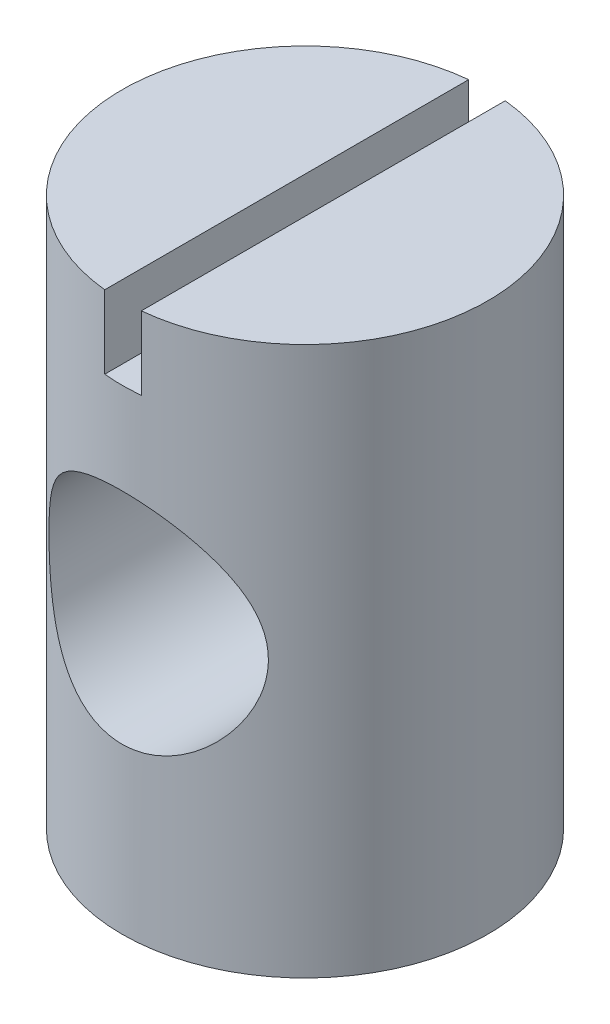
from build123d import *

# Parameters (mm, degrees)
SKETCH_1_R               = 5
EXTRUDE_1_DEPTH          = 15
SKETCH_2_W               = 1
SKETCH_2_H               = 10
CUT_EXTRUDE_1_DEPTH      = 2
CUT_EXTRUDE_2_DEPTH      = 5
CUT_EXTRUDE_2_DEPTH_BACK = 5
SKETCH_3_R               = 3


with BuildPart() as part:
    # Эскиз1 → Бобышка-Вытянуть1 (new body)
    with BuildSketch(Plane(origin=(0, 0, 0), x_dir=(1, 0, 0), z_dir=(0, 1, 0))):
        Circle(SKETCH_1_R)
    extrude(amount=EXTRUDE_1_DEPTH)

    # Эскиз2 → Вырез-Вытянуть1 (cut)
    with BuildSketch(Plane(origin=(0, 15, 0), x_dir=(1, 0, 0), z_dir=(0, 1, 0))):
        Rectangle(SKETCH_2_W, SKETCH_2_H)
    extrude(amount=-CUT_EXTRUDE_1_DEPTH, mode=Mode.SUBTRACT)

    # Эскиз3 → Вырез-Вытянуть2 (cut, two sides: drawn at the far end of the back side and taken through both)
    with BuildSketch(Plane.XY.offset(-CUT_EXTRUDE_2_DEPTH_BACK)):
        with Locations((0, 7.5)):
            Circle(SKETCH_3_R)
    extrude(amount=CUT_EXTRUDE_2_DEPTH + CUT_EXTRUDE_2_DEPTH_BACK, mode=Mode.SUBTRACT)


solid = part.part
